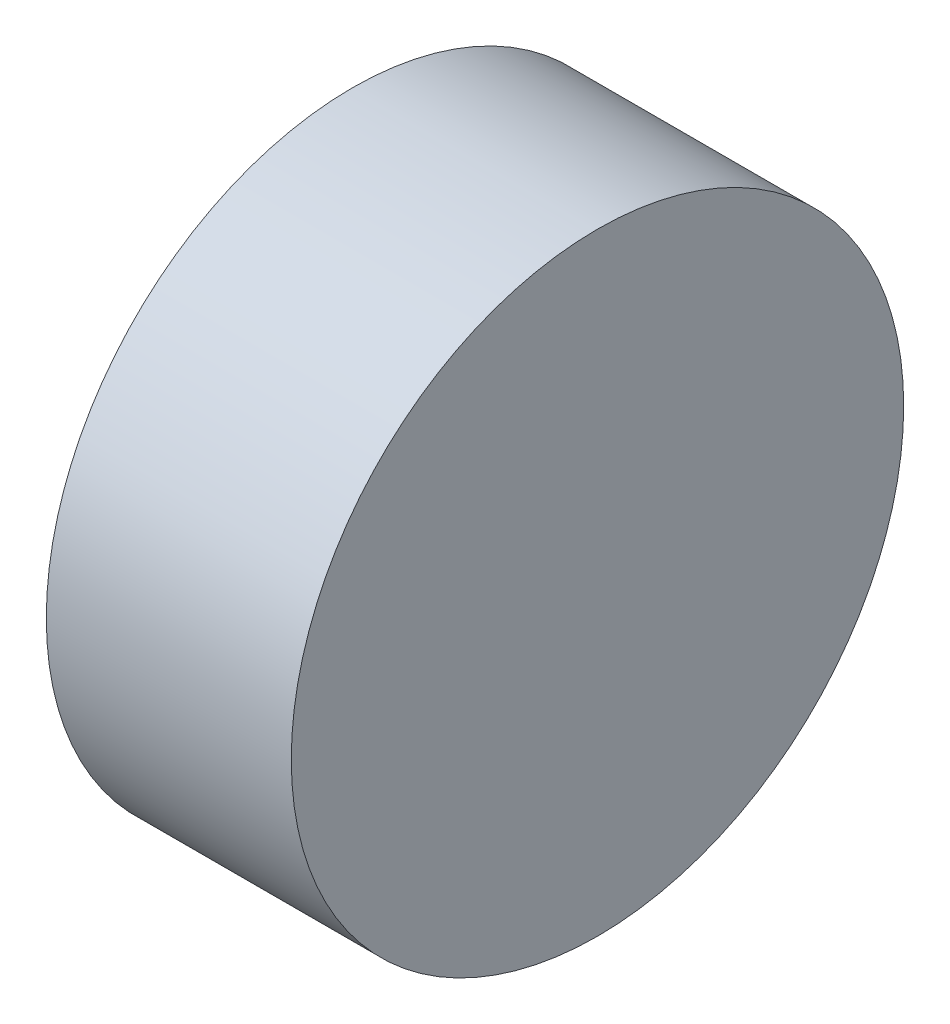
from build123d import *

# Parameters (mm, degrees)
SKETCH_1_R          = 10
EXTRUDE_1_DEPTH     = 4
SKETCH_2_R          = 6.5
SKETCH_2_R_2        = 2
SKETCH_2_R_3        = 1
CUT_EXTRUDE_1_DEPTH = 6


with BuildPart() as part:
    # 草图1 → 凸台-拉伸1 (new, symmetric)
    with BuildSketch(Plane(origin=(0, 0, 0), x_dir=(0, 0, -1), z_dir=(1, 0, 0))):
        Circle(SKETCH_1_R)
    extrude(amount=EXTRUDE_1_DEPTH, both=True)

    # 草图2 → 切除-拉伸1 (cut)
    # profile 1 of 2: a face of its own
    with BuildSketch(Plane.ZY.offset(4)):
        Circle(SKETCH_2_R)
        Circle(SKETCH_2_R_2, mode=Mode.SUBTRACT)
    # profile 2 of 2: a face of its own
    with BuildSketch(Plane.ZY.offset(4)):
        Circle(SKETCH_2_R_3)
    extrude(amount=-CUT_EXTRUDE_1_DEPTH, mode=Mode.SUBTRACT)


solid = part.part
